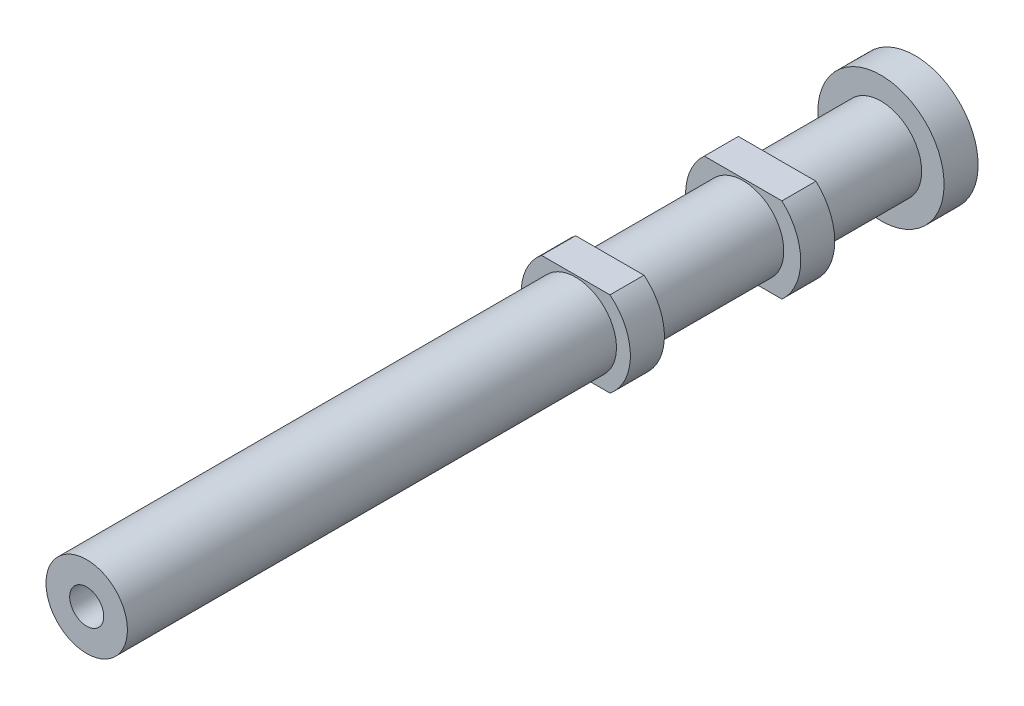
from build123d import *

# Parameters (mm, degrees)
SKETCH1_R           = 1.435
BOSS_EXTRUDE1_DEPTH = 14.6
SKETCH2_R           = 0.6
CUT_EXTRUDE1_DEPTH  = 5
SKETCH3_W           = 0.49
SKETCH3_H           = 1.2
SKETCH3_W_2         = 0.595
SKETCH3_W_3         = 0.79
CUT_EXTRUDE2_REACH  = 31.369
SKETCH4_W           = 4
SKETCH4_H           = 1


with BuildPart() as part:
    # Sketch1 → Boss-Extrude1 (new, symmetric)
    with BuildSketch(Plane.XY):
        Circle(SKETCH1_R)
    extrude(amount=BOSS_EXTRUDE1_DEPTH, both=True)

    # Sketch2 → Cut-Extrude1 (cut)
    with BuildSketch(Plane.XY.offset(14.6)):
        Circle(SKETCH2_R)
    extrude(amount=-CUT_EXTRUDE1_DEPTH, mode=Mode.SUBTRACT)

    # Sketch3 → Revolve1 (revolve)
    with BuildSketch(Plane(origin=(0, 0, 0), x_dir=(1, 0, 0), z_dir=(0, 1, 0)), mode=Mode.PRIVATE) as revolve1_sk:
        with Locations((1.68, 3.24)):
            Rectangle(SKETCH3_W, SKETCH3_H)
        with Locations((1.7325, 9.14)):
            Rectangle(SKETCH3_W_2, SKETCH3_H)
        with Locations((1.83, 14)):
            Rectangle(SKETCH3_W_3, SKETCH3_H)
    revolve(revolve1_sk.sketch.rotate(Axis((0, 0, -14.6), (0, 0, 1)), 180), axis=Axis((0, 0, -14.6), (0, 0, 1)))

    # Cut-Extrude2: up to this face of the body (flat: up to its plane)
    cut_extrude2_end = Plane(part.part.faces().sort_by_distance((-1.492417071, 0, -9.74))[0])
    # Sketch4 → Cut-Extrude2 (cut, up to the picked face)
    with BuildSketch(Plane.XY.offset(14.6), mode=Mode.PRIVATE) as cut_extrude2_sk1:
        with Locations((0, 2)):
            Rectangle(SKETCH4_W, SKETCH4_H)
    cut_extrude2_tool1 = split(extrude(cut_extrude2_sk1.sketch, amount=-CUT_EXTRUDE2_REACH, mode=Mode.PRIVATE), bisect_by=cut_extrude2_end, keep=Keep.BOTH, mode=Mode.PRIVATE)
    # Sketch4 → Cut-Extrude2 (cut, up to the picked face)
    with BuildSketch(Plane.XY.offset(14.6), mode=Mode.PRIVATE) as cut_extrude2_sk2:
        with Locations((0, -2)):
            Rectangle(SKETCH4_W, SKETCH4_H)
    cut_extrude2_tool2 = split(extrude(cut_extrude2_sk2.sketch, amount=-CUT_EXTRUDE2_REACH, mode=Mode.PRIVATE), bisect_by=cut_extrude2_end, keep=Keep.BOTH, mode=Mode.PRIVATE)
    add(cut_extrude2_tool1.solids().sort_by(Axis((0, 2, 14.6), (0, 0, -1)))[0], mode=Mode.SUBTRACT)
    add(cut_extrude2_tool2.solids().sort_by(Axis((0, -2, 14.6), (0, 0, -1)))[0], mode=Mode.SUBTRACT)


solid = part.part
